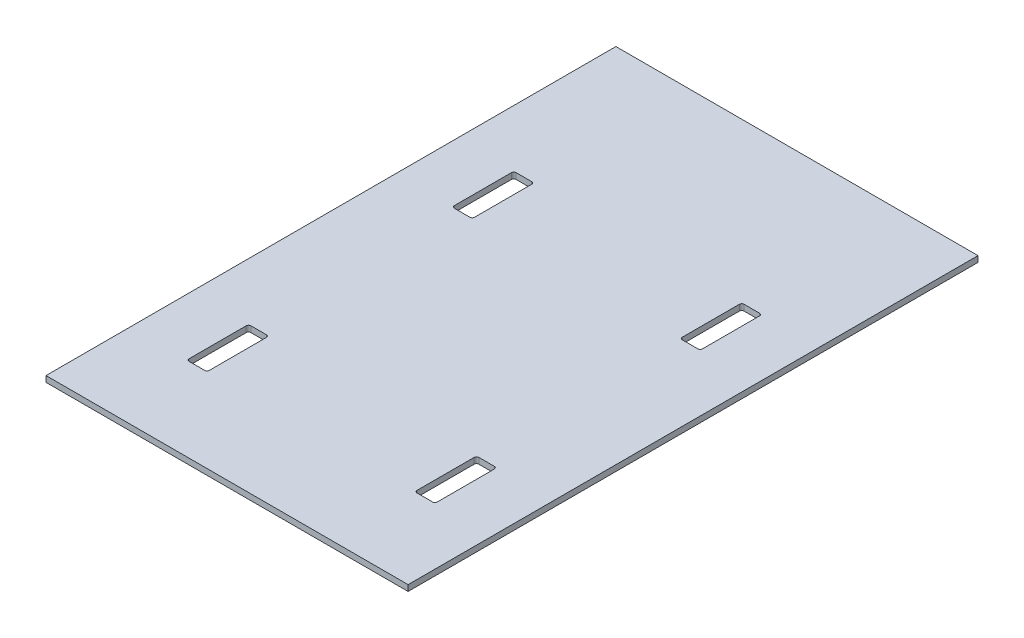
from build123d import *

# Parameters (mm, degrees)
SKETCH1_W           = 387.35
SKETCH1_H           = 609.6
BOSS_EXTRUDE1_DEPTH = 6.35
SKETCH2_W           = 21.59
SKETCH2_H           = 66.04
CUT_EXTRUDE1_DEPTH  = 362.183288823
FILLET1_R           = 2.54


with BuildPart() as part:
    # Sketch1 → Boss-Extrude1 (new body)
    with BuildSketch(Plane(origin=(0, 0, 0), x_dir=(1, 0, 0), z_dir=(0, 1, 0))):
        Rectangle(SKETCH1_W, SKETCH1_H)
    extrude(amount=BOSS_EXTRUDE1_DEPTH)

    # Sketch2 → Cut-Extrude1 (cut, through all)
    with BuildSketch(Plane(origin=(0, 6.35, 0), x_dir=(1, 0, 0), z_dir=(0, 1, 0))):
        with Locations((121.92, -182.118)):
            Rectangle(SKETCH2_W, SKETCH2_H)
        with Locations((121.92, 101.6)):
            Rectangle(SKETCH2_W, SKETCH2_H)
        with Locations((-121.92, -182.118)):
            Rectangle(SKETCH2_W, SKETCH2_H)
        with Locations((-121.92, 101.6)):
            Rectangle(SKETCH2_W, SKETCH2_H)
    extrude(amount=-CUT_EXTRUDE1_DEPTH, mode=Mode.SUBTRACT)

    # Fillet1
    fillet1_edges = [part.edges().sort_by_distance(p)[0] for p in [
        (132.715, 3.175, -134.62),
        (132.715, 3.175, -68.58),
        (111.125, 3.175, -68.58),
        (111.125, 3.175, -134.62),
        (-111.125, 3.175, 215.138),
        (-132.715, 3.175, 215.138),
        (-132.715, 3.175, 149.098),
        (-111.125, 3.175, 149.098),
        (-111.125, 3.175, -68.58),
        (-132.715, 3.175, -68.58),
        (-132.715, 3.175, -134.62),
        (-111.125, 3.175, -134.62),
        (132.715, 3.175, 149.098),
        (132.715, 3.175, 215.138),
        (111.125, 3.175, 215.138),
        (111.125, 3.175, 149.098),
    ]]
    fillet(fillet1_edges, radius=FILLET1_R)


solid = part.part
